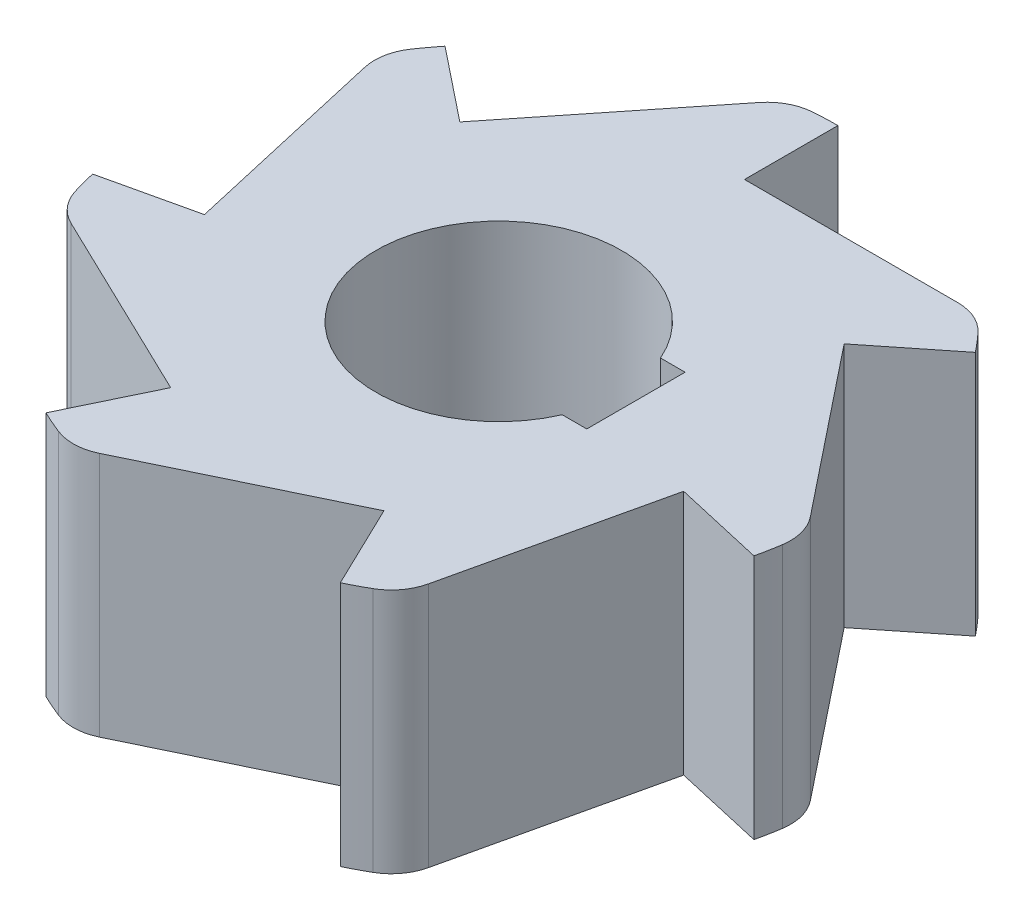
from build123d import *

# Parameters (mm, degrees)
BOSS_EXTRUDE1_DEPTH = 50


with BuildPart() as part:
    # Sketch1 → Boss-Extrude1 (new body)
    with BuildSketch(Plane(origin=(0, 0, 0), x_dir=(1, 0, 0), z_dir=(0, 1, 0))):
        with BuildLine():
            Line((0, 50), (43.370496884, 50))
            ThreePointArc((43.370496884, 50), (47.383188614, 49.159601797), (50.72142856, 46.779661017))
            ThreePointArc((50.72142856, 46.779661017), (52.367636949, 44.929173155), (53.94637229, 43.020796328))
            Line((53.94637229, 43.020796328), (39.091574123, 31.174490093))
            Line((39.091574123, 31.174490093), (66.132636632, -2.733929782))
            ThreePointArc((66.132636632, -2.733929782), (67.977459231, -6.395158214), (68.198105165, -10.488968105))
            ThreePointArc((68.198105165, -10.488968105), (67.777729639, -12.929785961), (67.270025941, -15.353944443))
            Line((67.270025941, -15.353944443), (48.746395609, -11.126046698))
            Line((48.746395609, -11.126046698), (39.095552136, -53.409154676))
            ThreePointArc((39.095552136, -53.409154676), (37.38331656, -57.134233653), (34.320217593, -59.859190308))
            ThreePointArc((34.320217593, -59.859190308), (32.149809497, -61.052352529), (29.937977999, -62.166851885))
            Line((29.937977999, -62.166851885), (21.694186956, -45.048443395))
            Line((21.694186956, -45.048443395), (-17.381280522, -63.866196751))
            ThreePointArc((-17.381280522, -63.866196751), (-21.361225962, -64.850065825), (-25.401493831, -64.154221304))
            ThreePointArc((-25.401493831, -64.154221304), (-27.687572933, -63.201252401), (-29.937977999, -62.166851885))
            Line((-29.937977999, -62.166851885), (-21.694186956, -45.048443395))
            Line((-21.694186956, -45.048443395), (-60.769654434, -26.23069004))
            ThreePointArc((-60.769654434, -26.23069004), (-64.020329644, -23.732475731), (-65.995362305, -20.13981515))
            ThreePointArc((-65.995362305, -20.13981515), (-66.675648221, -17.758320145), (-67.270025941, -15.353944443))
            Line((-67.270025941, -15.353944443), (-48.746395609, -11.126046698))
            Line((-48.746395609, -11.126046698), (-58.397239082, 31.15706128))
            ThreePointArc((-58.397239082, 31.15706128), (-58.470819328, 35.256152643), (-56.893376903, 39.040282589))
            ThreePointArc((-56.893376903, 39.040282589), (-55.455600463, 41.056989384), (-53.94637229, 43.020796328))
            Line((-53.94637229, 43.020796328), (-39.091574123, 31.174490093))
            Line((-39.091574123, 31.174490093), (-12.050511614, 65.082909967))
            ThreePointArc((-12.050511614, 65.082909967), (-8.89158947, 67.696178982), (-4.94951828, 68.822251262))
            ThreePointArc((-4.94951828, 68.822251262), (-2.476354468, 68.955548497), (0, 69))
            Line((0, 69), (0, 50))
        make_face()
        with BuildLine():
            Line((27.912878475, -10), (27.912878475, 10))
            Line((27.912878475, 10), (22.912878475, 10))
            ThreePointArc((22.912878475, 10), (-25, 0), (22.912878475, -10))
            Line((22.912878475, -10), (27.912878475, -10))
        make_face(mode=Mode.SUBTRACT)
    extrude(amount=BOSS_EXTRUDE1_DEPTH)


solid = part.part
